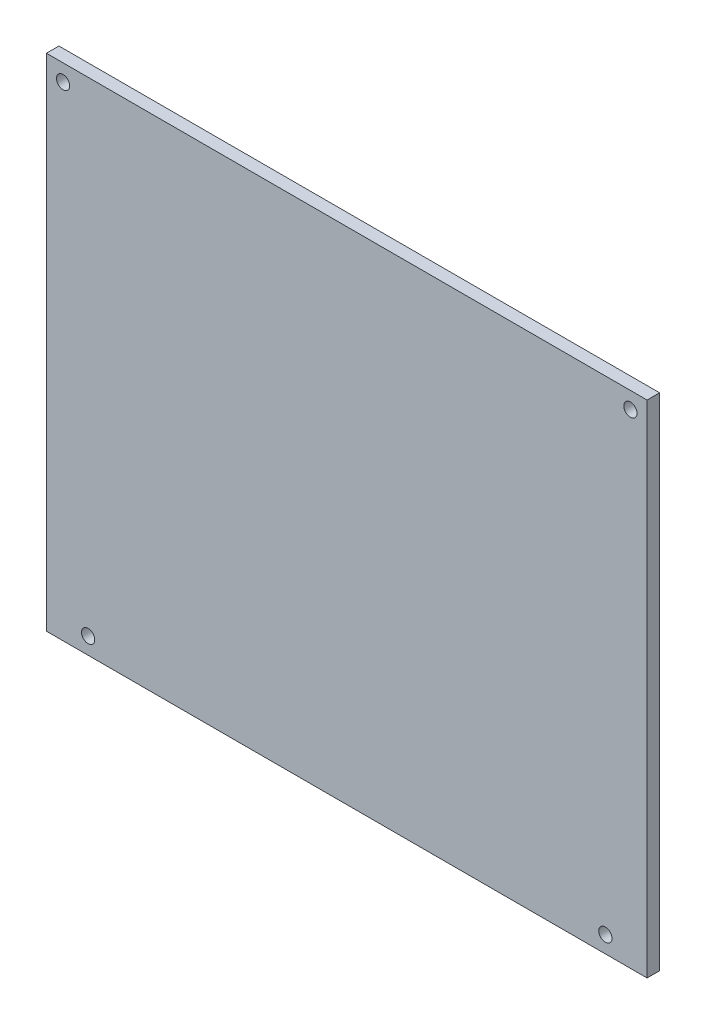
from build123d import *

# Parameters (mm, degrees)
BOSS_EXTRUDE1_DEPTH         = 9.525
F_3_8_CLEARANCE_HOLE1_D     = 10.0838
F_3_8_CLEARANCE_HOLE1_DEPTH = 25.4
F_3_8_CLEARANCE_HOLE1_TIP   = 3.029479155


with BuildPart() as part:
    # Sketch1 → Boss-Extrude1 (new body)
    with BuildSketch(Plane.XY):
        Polygon((-228.6, -36.83), (-228.6, -189.23), (228.6, -189.23), (228.6, -36.83), (228.6, 191.77), (-228.6, 191.77), align=None)
    extrude(amount=BOSS_EXTRUDE1_DEPTH)

    # 3/8 Clearance Hole1
    with Locations(Plane.XY.offset(9.525)):
        with Locations((-215.9, 179.07), (215.9, 179.07), (196.85, -176.53), (-196.85, -176.53)):
            Hole(F_3_8_CLEARANCE_HOLE1_D / 2, depth=F_3_8_CLEARANCE_HOLE1_DEPTH)
            with Locations((0, 0, -(F_3_8_CLEARANCE_HOLE1_DEPTH + F_3_8_CLEARANCE_HOLE1_TIP / 2))):  # 118° drill point
                Cone(0, F_3_8_CLEARANCE_HOLE1_D / 2, F_3_8_CLEARANCE_HOLE1_TIP, mode=Mode.SUBTRACT)


solid = part.part
